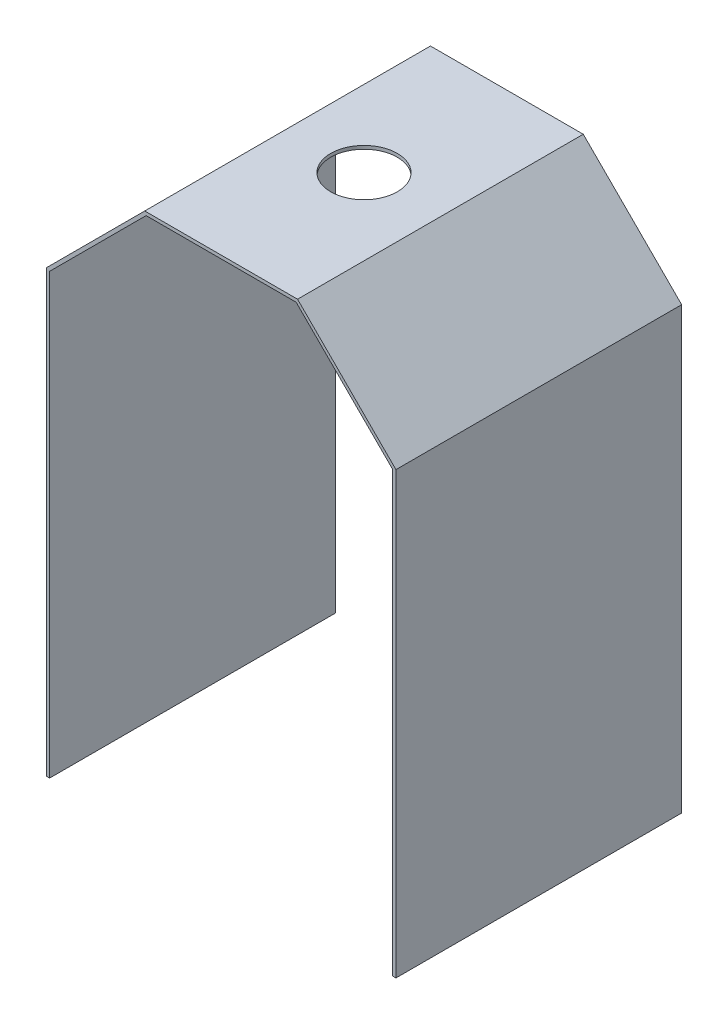
from build123d import *

# Parameters (mm, degrees)
EXTRUDE_1_DEPTH     = 171.62
SKETCH_2_R          = 20
CUT_EXTRUDE_1_DEPTH = 384.382537519


with BuildPart() as part:
    # Эскиз1 → Вытянуть-Тонкостенный1 (new body)
    with BuildSketch(Plane.XY):
        Polygon((-96.72523491, 314.926453532), (-96.72523491, 579.392619017), (-37.621355545, 638.496497272), (54.170886835, 638.496497272), (113.274765367, 579.39261874), (113.27476147, 314.926454672), (111.27476147, 314.926454702), (111.274765355, 578.564191627), (53.34245971, 636.496497272), (-36.792928431, 636.496497272), (-94.72523491, 578.564191882), (-94.72523491, 314.926453532), align=None)
    extrude(amount=EXTRUDE_1_DEPTH)

    # Эскиз2 → Вырез-Вытянуть1 (cut, through all)
    with BuildSketch(Plane(origin=(0, 638.496497272, 0), x_dir=(1, 0, 0), z_dir=(0, 1, 0))):
        with Locations(Location((8.274765645, -85.81, 0), (0, 0, 270))):
            Circle(SKETCH_2_R)
    extrude(amount=-CUT_EXTRUDE_1_DEPTH, mode=Mode.SUBTRACT)


solid = part.part
